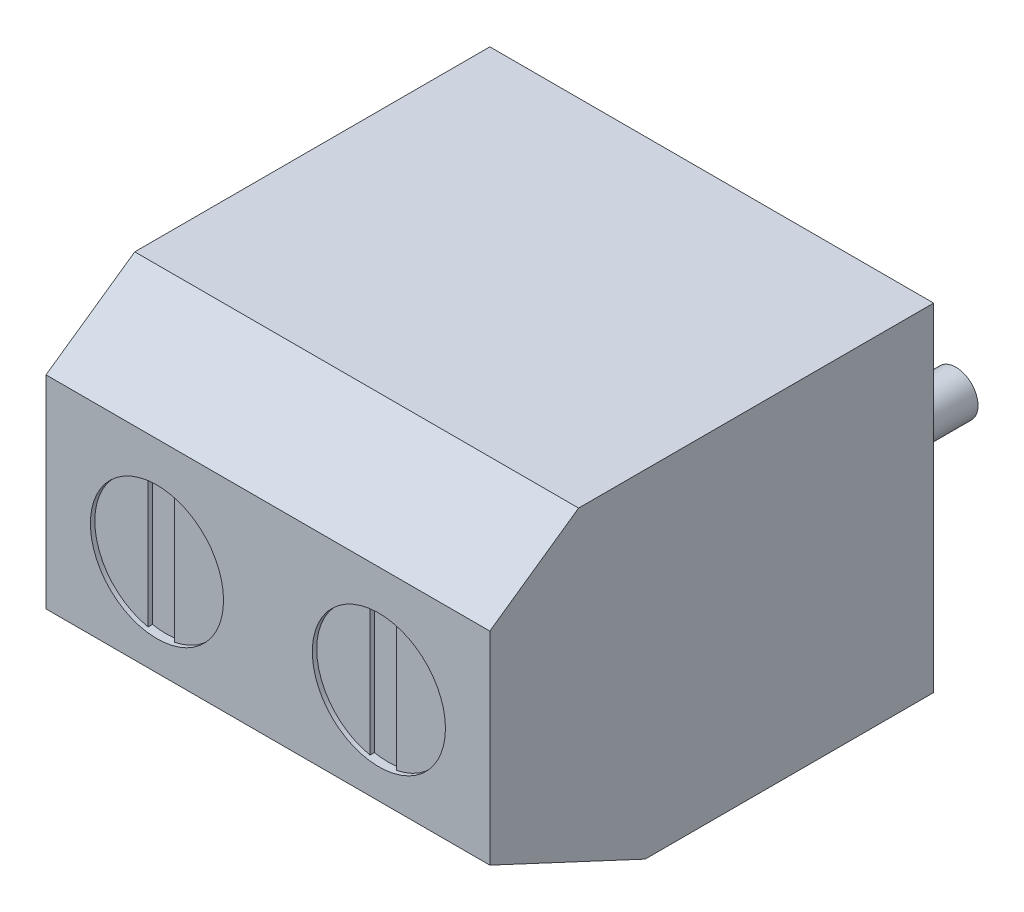
from build123d import *
from build123d.topology import SkipClean

# Parameters (mm, degrees)
SKETCH_1_W             = 10
SKETCH_1_H             = 7.6
EXTRUDE_1_DEPTH        = 10
SKETCH_2_R             = 1.5
CUT_EXTRUDE_1_DEPTH    = 0.1
CUT_EXTRUDE_2_DEPTH    = 0.1
SKETCH_4_W             = 3
SKETCH_4_H             = 4.7
CUT_EXTRUDE_3_DEPTH    = 2
SKETCH_5_R             = 0.5
EXTRUDE_2_DEPTH        = 3
PATTERN_LINEAR_1_COUNT = 2
PATTERN_LINEAR_1_PITCH = 5
CHAMFER_1_SIZE         = 3.5
CHAMFER_1_SIZE2        = 1.632076804
CHAMFER_2_SIZE         = 2
CHAMFER_2_SIZE2        = 1.400415076


with BuildPart() as part:
    # Эскиз1 → Бобышка-Вытянуть1 (new body)
    with BuildSketch(Plane.XY):
        Rectangle(SKETCH_1_W, SKETCH_1_H)
    extrude(amount=EXTRUDE_1_DEPTH)

    # Эскиз2 → Вырез-Вытянуть1 (cut)
    with BuildSketch(Plane.XY.offset(10)):
        with Locations((2.5, 0)):
            Circle(SKETCH_2_R)
    cut_extrude_1 = extrude(amount=-CUT_EXTRUDE_1_DEPTH, mode=Mode.SUBTRACT)

    # Эскиз3 → Вырез-Вытянуть2 (cut)
    with SkipClean():  # the faces are left unmerged after this step: merging them gives an invalid solid
        with BuildSketch(Plane.XY.offset(9.9)):
            with BuildLine():
                Line((2.2, -1.469693846), (2.2, 1.469693846))
                ThreePointArc((2.2, 1.469693846), (2.5, 1.5), (2.8, 1.469693846))
                Line((2.8, 1.469693846), (2.8, -1.469693846))
                ThreePointArc((2.8, -1.469693846), (2.5, -1.5), (2.2, -1.469693846))
            make_face()
        cut_extrude_2 = extrude(amount=-CUT_EXTRUDE_2_DEPTH, mode=Mode.SUBTRACT)

    # Эскиз4 → Вырез-Вытянуть3 (cut)
    with SkipClean():  # the faces are left unmerged after this step: merging them gives an invalid solid
        with BuildSketch(Plane.XZ.offset(3.8)):
            with Locations((2.5, 2.85)):
                Rectangle(SKETCH_4_W, SKETCH_4_H)
        cut_extrude_3 = extrude(amount=-CUT_EXTRUDE_3_DEPTH, mode=Mode.SUBTRACT)

    # Эскиз5 → Бобышка-Вытянуть2 (add)
    with SkipClean():  # the faces are left unmerged after this step: merging them gives an invalid solid
        with BuildSketch(Plane(origin=(0, 0, 0), x_dir=(-1, 0, 0), z_dir=(0, 0, -1))):
            with Locations((-2.5, -0.7)):
                Circle(SKETCH_5_R)
        extrude_2 = extrude(amount=EXTRUDE_2_DEPTH)

    # Линейный массив1: Вырез-Вытянуть1, Вырез-Вытянуть2, Вырез-Вытянуть3, Бобышка-Вытянуть2 ×2
    with SkipClean():  # the faces are left unmerged after this step: merging them gives an invalid solid
        with Locations(*[(-i * PATTERN_LINEAR_1_PITCH, 0, 0) for i in range(1, PATTERN_LINEAR_1_COUNT)]):
            add(cut_extrude_1, mode=Mode.SUBTRACT)
            add(cut_extrude_2, mode=Mode.SUBTRACT)
            add(cut_extrude_3, mode=Mode.SUBTRACT)
            add(extrude_2)

    # Фаска1
    chamfer_1_edges = [part.edges().sort_by_distance(p)[0] for p in [
        (0, -3.8, 10),
    ]]
    chamfer_1_side = [part.faces().sort_by_distance(p)[0] for p in [
        (0, -3.8, 5.844428969),
    ]]
    chamfer(chamfer_1_edges, length=CHAMFER_1_SIZE, length2=CHAMFER_1_SIZE2, reference=chamfer_1_side[0])

    # Фаска2
    chamfer_2_edges = [part.edges().sort_by_distance(p)[0] for p in [
        (0, 3.8, 10),
    ]]
    chamfer_2_side = [part.faces().sort_by_distance(p)[0] for p in [
        (0, 3.8, 5),
    ]]
    chamfer(chamfer_2_edges, length=CHAMFER_2_SIZE, length2=CHAMFER_2_SIZE2, reference=chamfer_2_side[0])


solid = part.part
